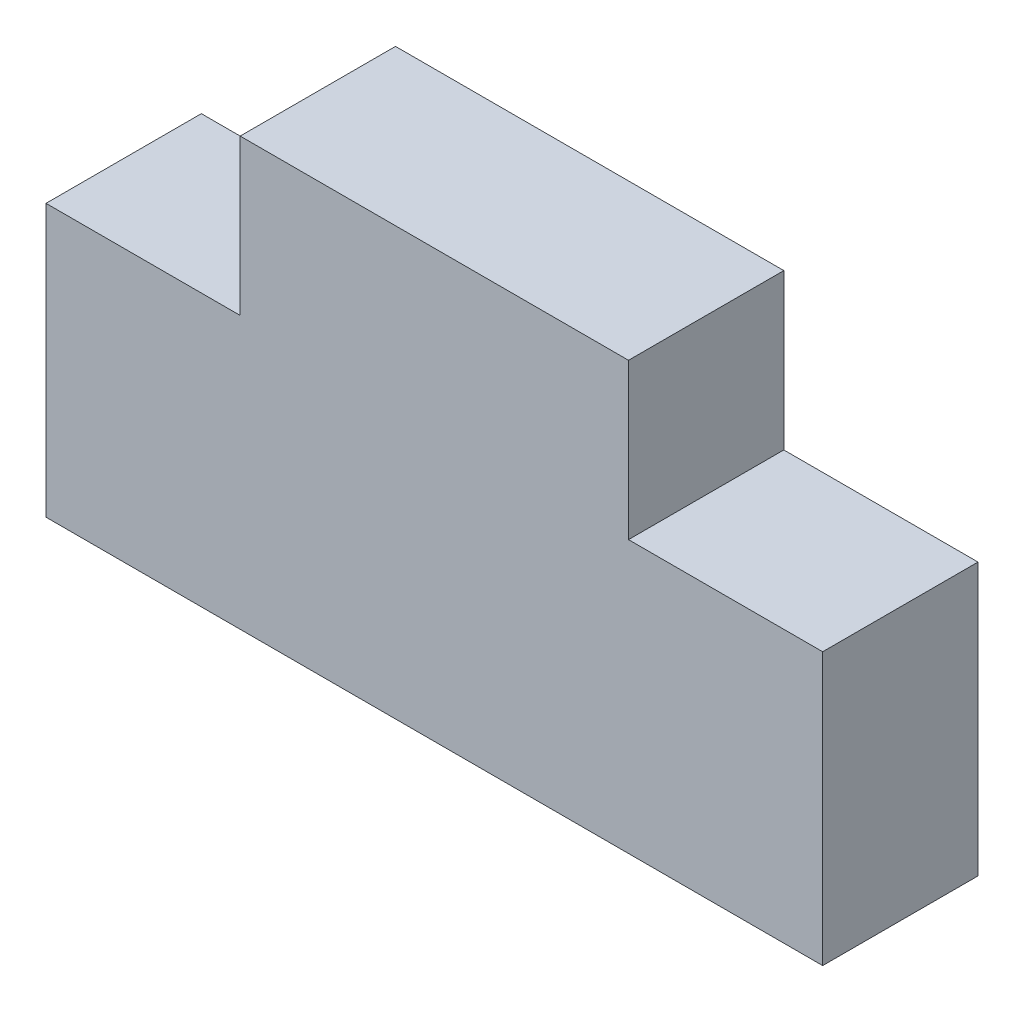
from build123d import *

# Parameters (mm, degrees)
BOSS_EXTRUDE1_DEPTH = 2


with BuildPart() as part:
    # Sketch1 → Boss-Extrude1 (new body)
    with BuildSketch(Plane.XY):
        Polygon((-2.5, 5.5), (2.5, 5.5), (2.5, 3.5), (5, 3.5), (5, 0), (-5, 0), (-5, 3.5), (-2.5, 3.5), align=None)
    extrude(amount=BOSS_EXTRUDE1_DEPTH)


solid = part.part
